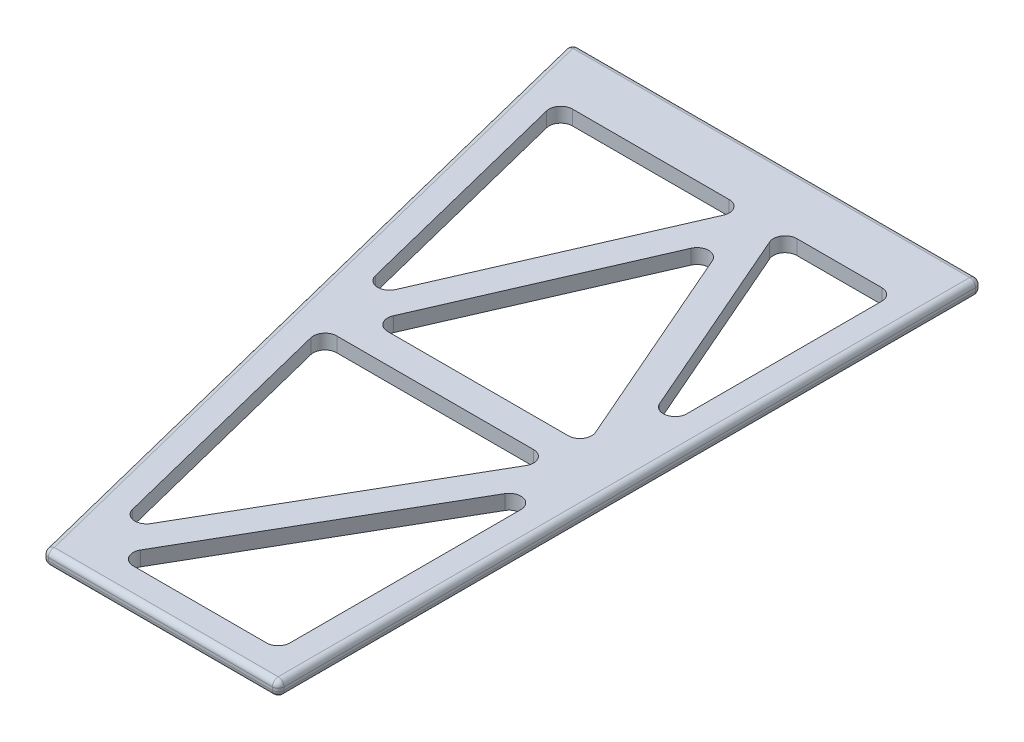
from build123d import *

# Parameters (mm, degrees)
SKETCH1_W           = 254
SKETCH1_H           = 6.35
BOSS_EXTRUDE1_DEPTH = 304.8
CUT_EXTRUDE1_DEPTH  = 304.8
CUT_EXTRUDE2_DEPTH  = 397.811494919
CUT_EXTRUDE3_REACH  = 398.811
FILLET2_R           = 2.54


with BuildPart() as part:
    # Sketch1 → Boss-Extrude1 (new body)
    with BuildSketch(Plane.XY):
        with Locations((-127, 3.175)):
            Rectangle(SKETCH1_W, SKETCH1_H)
    extrude(amount=BOSS_EXTRUDE1_DEPTH)

    # Sketch2 → Cut-Extrude1 (cut)
    with BuildSketch(Plane(origin=(0, 6.35, 0), x_dir=(1, 0, 0), z_dir=(0, 1, 0))):
        Polygon((-177.8, -304.8), (-254, 0), (-254, -304.8), align=None)
    extrude(amount=-CUT_EXTRUDE1_DEPTH, mode=Mode.SUBTRACT)

    # Sketch4 → Cut-Extrude2 (cut, through all)
    with BuildSketch(Plane(origin=(0, 6.35, 0), x_dir=(1, 0, 0), z_dir=(0, 1, 0))):
        Polygon((-76.2, -127), (-76.2, 0), (0, 0), (0, -304.8), (-76.2, -304.8), (-76.2, -177.8), align=None)
    extrude(amount=-CUT_EXTRUDE2_DEPTH, mode=Mode.SUBTRACT)

    # Sketch7 → Cut-Extrude3 (cut, up to next)
    with BuildSketch(Plane(origin=(0, 0, 0), x_dir=(-1, 0, 0), z_dir=(0, -1, 0)), mode=Mode.PRIVATE) as cut_extrude3_sk1:
        with BuildLine():
            ThreePointArc((98.637189175, -117.047779868), (92.943689479, -119.991917487), (88.9, -115.0187434))
            Line((88.9, -115.0187434), (88.9, -30.48))
            ThreePointArc((88.9, -30.48), (90.387897552, -26.887897552), (93.98, -25.4))
            Line((93.98, -25.4), (130.811699734, -25.4))
            ThreePointArc((130.811699734, -25.4), (135.061047052, -27.696217075), (135.468888909, -32.509036468))
            Line((135.468888909, -32.509036468), (98.637189175, -117.047779868))
        make_face()
    cut_extrude3_tool1 = extrude(cut_extrude3_sk1.sketch, amount=-CUT_EXTRUDE3_REACH, mode=Mode.PRIVATE) & part.part
    # Sketch7 → Cut-Extrude3 (cut, up to next)
    with BuildSketch(Plane(origin=(0, 0, 0), x_dir=(-1, 0, 0), z_dir=(0, -1, 0)), mode=Mode.PRIVATE) as cut_extrude3_sk2:
        with BuildLine():
            Line((198.646676859, -131.504754308), (155.51638644, -32.509036468))
            ThreePointArc((155.51638644, -32.509036468), (155.924228297, -27.696217075), (160.173575615, -25.4))
            Line((160.173575615, -25.4), (228.052795494, -25.4))
            ThreePointArc((228.052795494, -25.4), (232.056879119, -27.353705976), (232.981119395, -31.712080975))
            Line((232.981119395, -31.712080975), (208.232189935, -130.707798815))
            ThreePointArc((208.232189935, -130.707798815), (203.724773416, -134.538250504), (198.646676859, -131.504754308))
        make_face()
    cut_extrude3_tool2 = extrude(cut_extrude3_sk2.sketch, amount=-CUT_EXTRUDE3_REACH, mode=Mode.PRIVATE) & part.part
    # Sketch7 → Cut-Extrude3 (cut, up to next)
    with BuildSketch(Plane(origin=(0, 0, 0), x_dir=(-1, 0, 0), z_dir=(0, -1, 0)), mode=Mode.PRIVATE) as cut_extrude3_sk3:
        with BuildLine():
            ThreePointArc((156.152382169, -284.48), (156.152382169, -289.56), (151.752973118, -292.1))
            Line((151.752973118, -292.1), (93.98, -292.1))
            ThreePointArc((93.98, -292.1), (90.387897552, -290.612102448), (88.9, -287.02))
            Line((88.9, -287.02), (88.9, -186.954275256))
            ThreePointArc((88.9, -186.954275256), (92.665199251, -182.047372059), (98.379409051, -184.414275256))
            Line((98.379409051, -184.414275256), (156.152382169, -284.48))
        make_face()
    cut_extrude3_tool3 = extrude(cut_extrude3_sk3.sketch, amount=-CUT_EXTRUDE3_REACH, mode=Mode.PRIVATE) & part.part
    # Sketch7 → Cut-Extrude3 (cut, up to next)
    with BuildSketch(Plane(origin=(0, 0, 0), x_dir=(-1, 0, 0), z_dir=(0, -1, 0)), mode=Mode.PRIVATE) as cut_extrude3_sk4:
        with BuildLine():
            Line((173.146484204, -271.050621738), (198.919755106, -167.957538129))
            ThreePointArc((198.919755106, -167.957538129), (197.995514831, -163.59916313), (193.991431206, -161.645457154))
            Line((193.991431206, -161.645457154), (108.69734073, -161.645457154))
            ThreePointArc((108.69734073, -161.645457154), (104.297931679, -164.185457154), (104.297931679, -169.265457154))
            Line((104.297931679, -169.265457154), (163.818751252, -272.358540762))
            ThreePointArc((163.818751252, -272.358540762), (168.923568535, -274.849325912), (173.146484204, -271.050621738))
        make_face()
    cut_extrude3_tool4 = extrude(cut_extrude3_sk4.sketch, amount=-CUT_EXTRUDE3_REACH, mode=Mode.PRIVATE) & part.part
    # Sketch7 → Cut-Extrude3 (cut, up to next)
    with BuildSketch(Plane(origin=(0, 0, 0), x_dir=(-1, 0, 0), z_dir=(0, -1, 0)), mode=Mode.PRIVATE) as cut_extrude3_sk5:
        with BuildLine():
            ThreePointArc((106.347495425, -148.945457154), (102.098148107, -146.649240078), (101.69030625, -141.836420686))
            Line((101.69030625, -141.836420686), (140.835448499, -51.987699072))
            ThreePointArc((140.835448499, -51.987699072), (145.492637674, -48.93673554), (150.14982685, -51.987699072))
            Line((150.14982685, -51.987699072), (189.2949691, -141.836420686))
            ThreePointArc((189.2949691, -141.836420686), (188.887127243, -146.649240078), (184.637779925, -148.945457154))
            Line((184.637779925, -148.945457154), (106.347495425, -148.945457154))
        make_face()
    cut_extrude3_tool5 = extrude(cut_extrude3_sk5.sketch, amount=-CUT_EXTRUDE3_REACH, mode=Mode.PRIVATE) & part.part
    add(cut_extrude3_tool1.solids().sort_by_distance((-105.779096, 0, 61.624334))[0], mode=Mode.SUBTRACT)
    add(cut_extrude3_tool2.solids().sort_by_distance((-197.184891, 0, 64.864333))[0], mode=Mode.SUBTRACT)
    add(cut_extrude3_tool3.solids().sort_by_distance((-112.936879, 0, 251.56545))[0], mode=Mode.SUBTRACT)
    add(cut_extrude3_tool4.solids().sort_by_distance((-156.854236, 0, 201.939756))[0], mode=Mode.SUBTRACT)
    add(cut_extrude3_tool5.solids().sort_by_distance((-145.492638, 0, 113.262605))[0], mode=Mode.SUBTRACT)

    # Fillet2
    fillet2_edges = [part.edges().sort_by_distance(p)[0] for p in [
        (-215.9, 0, 152.4),
        (-215.9, 6.35, 152.4),
        (-177.8, 3.175, 304.8),
        (-165.1, 0, 0),
        (-165.1, 6.35, 0),
        (-127, 6.35, 304.8),
        (-127, 0, 304.8),
        (-76.2, 6.35, 152.4),
        (-76.2, 3.175, 304.8),
        (-76.2, 3.175, 0),
        (-76.2, 0, 152.4),
        (-254, 3.175, 0),
    ]]
    fillet(fillet2_edges, radius=FILLET2_R)


solid = part.part
